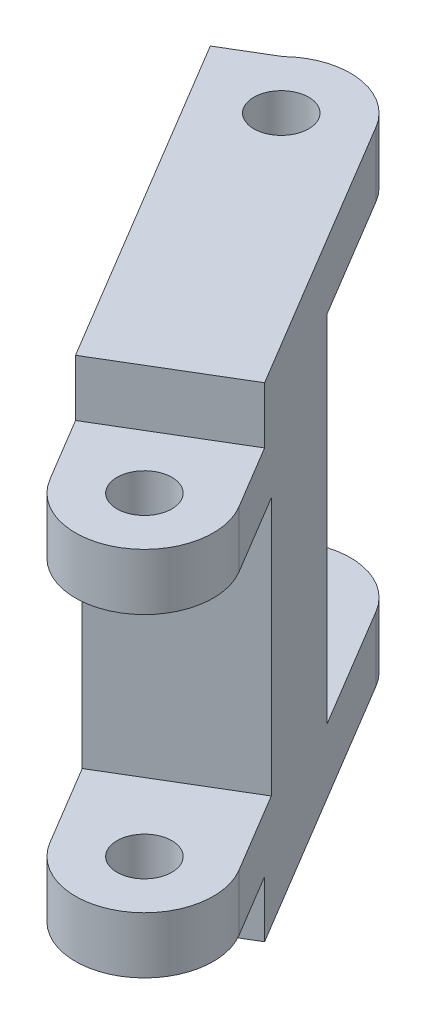
from build123d import *

# Parameters (mm, degrees)
SKETCH1_R           = 1.7
BOSS_EXTRUDE1_DEPTH = 30
SKETCH2_W           = 13
SKETCH2_H           = 22
SKETCH2_W_2         = 7.133537961
CUT_EXTRUDE2_DEPTH  = 30
SKETCH3_W           = 16.393620584
SKETCH3_H           = 16
CUT_EXTRUDE3_DEPTH  = 30
CUT_EXTRUDE4_DEPTH  = 3.5
CUT_EXTRUDE5_DEPTH  = 78.230456788


with BuildPart() as part:
    # Sketch1 → Boss-Extrude1 (new body)
    with BuildSketch(Plane(origin=(0, 0, 0), x_dir=(1, 0, 0), z_dir=(0, 1, 0))):
        with BuildLine():
            Line((0.547347337, 46.773363131), (-12.096275709, 67.916751063))
            ThreePointArc((-12.096275709, 67.916751063), (-15.207212104, 69.964878097), (-18.746235825, 68.803817933))
            Line((-18.746235825, 68.803817933), (-21.570135396, 67.115142409))
            Line((-21.570135396, 67.115142409), (-6.784148434, 42.389171288))
            ThreePointArc((-6.784148434, 42.389171288), (-0.926304627, 40.915519323), (0.547347337, 46.773363131))
        make_face()
        with Locations(Location((-3.118400548, 44.581267209, 0), (0, 0, 270))):
            Circle(SKETCH1_R, mode=Mode.SUBTRACT)
        with Locations(Location((-15.773770801, 65.71763038, 0), (0, 0, 270))):
            Circle(SKETCH1_R, mode=Mode.SUBTRACT)
    extrude(amount=BOSS_EXTRUDE1_DEPTH)

    # Sketch2 → Cut-Extrude2 (cut)
    with BuildSketch(Plane(origin=(13.674403301, 0, -8.177213665), x_dir=(0.5132293910361586, 0, 0.8582514737398672), z_dir=(-0.8582514737398672, 0, 0.5132293910361586))):
        with Locations((-62.172097336, 15)):
            Rectangle(SKETCH2_W, SKETCH2_H)
        with Locations((-72.238866317, 15)):
            Rectangle(SKETCH2_W_2, SKETCH2_H)
    extrude(amount=-CUT_EXTRUDE2_DEPTH, mode=Mode.SUBTRACT)

    # Sketch3 → Cut-Extrude3 (cut)
    with BuildSketch(Plane(origin=(13.674403301, 0, -8.177213665), x_dir=(0.5132293910361586, 0, 0.8582514737398672), z_dir=(-0.8582514737398672, 0, 0.5132293910361586))):
        with Locations((-37.475287044, 15)):
            Rectangle(SKETCH3_W, SKETCH3_H)
    extrude(amount=-CUT_EXTRUDE3_DEPTH, mode=Mode.SUBTRACT)

    # Sketch7 → Cut-Extrude4 (cut)
    with BuildSketch(Plane(origin=(0, 0, 0), x_dir=(-1, 0, 0), z_dir=(0, -1, 0))):
        Polygon((1.817751365, 50.728416138), (9.149247136, 46.344224296), (4.210618406, 38.085567524), (-3.391020631, 42.018010382), align=None)
    extrude(amount=-CUT_EXTRUDE4_DEPTH, mode=Mode.SUBTRACT)

    # Sketch9 → Cut-Extrude5 (cut, through all)
    with BuildSketch(Plane(origin=(13.674403301, 0, -8.177213665), x_dir=(0.5132293910361586, 0, 0.8582514737398672), z_dir=(-0.8582514737398672, 0, 0.5132293910361586))):
        Polygon((-44.470661337, 30), (-44.470661337, 26.5), (-33.41668301, 26.5), (-33.41668301, 30.544862053), (-44.470661337, 30.544862053), align=None)
    extrude(amount=-CUT_EXTRUDE5_DEPTH, mode=Mode.SUBTRACT)


solid = part.part
